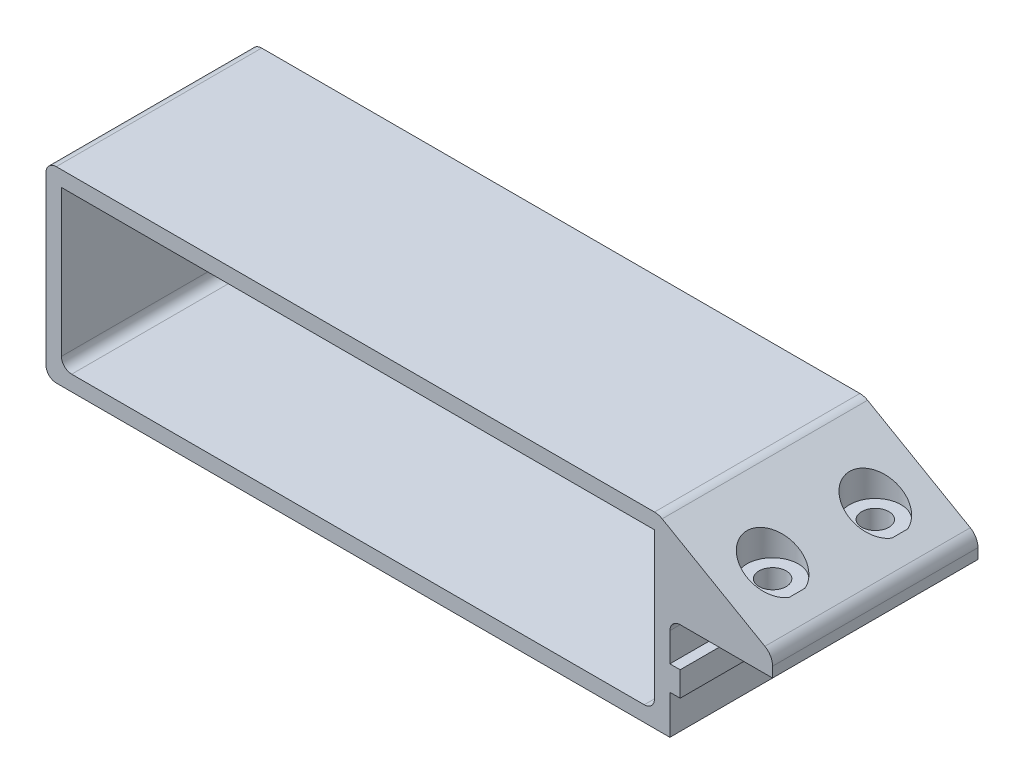
from build123d import *

# Parameters (mm, degrees)
SKETCH1_W                      = 115.5
SKETCH1_H                      = 30.5
SKETCH1_W_2                    = 88
SKETCH1_H_2                    = 12
BOSS_EXTRUDE1_DEPTH            = 3
BOSS_EXTRUDE2_START            = 37
SKETCH1_3_W                    = 115.5
SKETCH1_3_H                    = 30.5
BOSS_EXTRUDE2_DEPTH            = 37
CBORE_FOR_M5_SHCS1_D           = 5.3
CBORE_FOR_M5_SHCS1_CBORE_D     = 10
CBORE_FOR_M5_SHCS1_CBORE_DEPTH = 9.75
FILLET1_R                      = 2


with BuildPart() as part:
    # Sketch1 → Boss-Extrude1 (new body)
    # profile 1 of 2: a face of its own
    with BuildSketch(Plane.XY):
        with BuildLine():
            Line((23, 17), (23, 19))
            ThreePointArc((23, 19), (22.596751829, 20.502291563), (21.495413373, 21.600718909))
            Line((21.495413373, 21.600718909), (1.495413373, 33.100718909))
            ThreePointArc((1.495413373, 33.100718909), (0.773900275, 33.398461379), (0, 33.5))
            Line((0, 33.5), (-118.5, 33.5))
            Line((-118.5, 33.5), (-118.5, -3))
            Line((-118.5, -3), (3, -3))
            Line((3, -3), (3, 4.6))
            Line((3, 4.6), (5, 4.6))
            Line((5, 4.6), (5, 9.4))
            Line((5, 9.4), (3, 9.4))
            Line((3, 9.4), (3, 17))
            Line((3, 17), (23, 17))
        make_face()
        with Locations((-57.75, 15.25)):
            Rectangle(SKETCH1_W, SKETCH1_H, mode=Mode.SUBTRACT)
    # profile 2 of 2: a face of its own
    with BuildSketch(Plane.XY):
        with Locations((-57.75, 15.25)):
            Rectangle(SKETCH1_W, SKETCH1_H)
        with Locations((-66.5, 16)):
            Rectangle(SKETCH1_W_2, SKETCH1_H_2, mode=Mode.SUBTRACT)
    extrude(amount=-BOSS_EXTRUDE1_DEPTH)

    # Sketch1<3> → Boss-Extrude2 (add)
    with BuildSketch(Plane.XY.offset(BOSS_EXTRUDE2_START)):
        with BuildLine():
            Line((23, 17), (23, 19))
            ThreePointArc((23, 19), (22.596751829, 20.502291563), (21.495413373, 21.600718909))
            Line((21.495413373, 21.600718909), (1.495413373, 33.100718909))
            ThreePointArc((1.495413373, 33.100718909), (0.773900275, 33.398461379), (0, 33.5))
            Line((0, 33.5), (-118.5, 33.5))
            Line((-118.5, 33.5), (-118.5, -3))
            Line((-118.5, -3), (3, -3))
            Line((3, -3), (3, 4.6))
            Line((3, 4.6), (5, 4.6))
            Line((5, 4.6), (5, 9.4))
            Line((5, 9.4), (3, 9.4))
            Line((3, 9.4), (3, 17))
            Line((3, 17), (23, 17))
        make_face()
        with Locations((-57.75, 15.25)):
            Rectangle(SKETCH1_3_W, SKETCH1_3_H, mode=Mode.SUBTRACT)
    extrude(amount=-BOSS_EXTRUDE2_DEPTH)

    # CBORE for M5 SHCS1 (through all)
    with Locations(Plane(origin=(0, 33.5, 0), x_dir=(1, 0, 0), z_dir=(0, 1, 0))):
        with Locations((13, -27), (13, -7)):
            CounterBoreHole(CBORE_FOR_M5_SHCS1_D / 2, CBORE_FOR_M5_SHCS1_CBORE_D / 2, CBORE_FOR_M5_SHCS1_CBORE_DEPTH)

    # Fillet1
    fillet1_edges = [part.edges().sort_by_distance(p)[0] for p in [
        (-22.5, 22, -1.5),
        (-110.5, 22, -1.5),
        (-110.5, 10, -1.5),
        (-22.5, 10, -1.5),
        (3, 17, 17),
        (-118.5, -3, 17),
        (-118.5, 33.5, 17),
        (0, 0, 18.5),
        (-57.75, 0, 0),
        (-115.5, 0, 18.5),
    ]]
    fillet(fillet1_edges, radius=FILLET1_R)


solid = part.part
